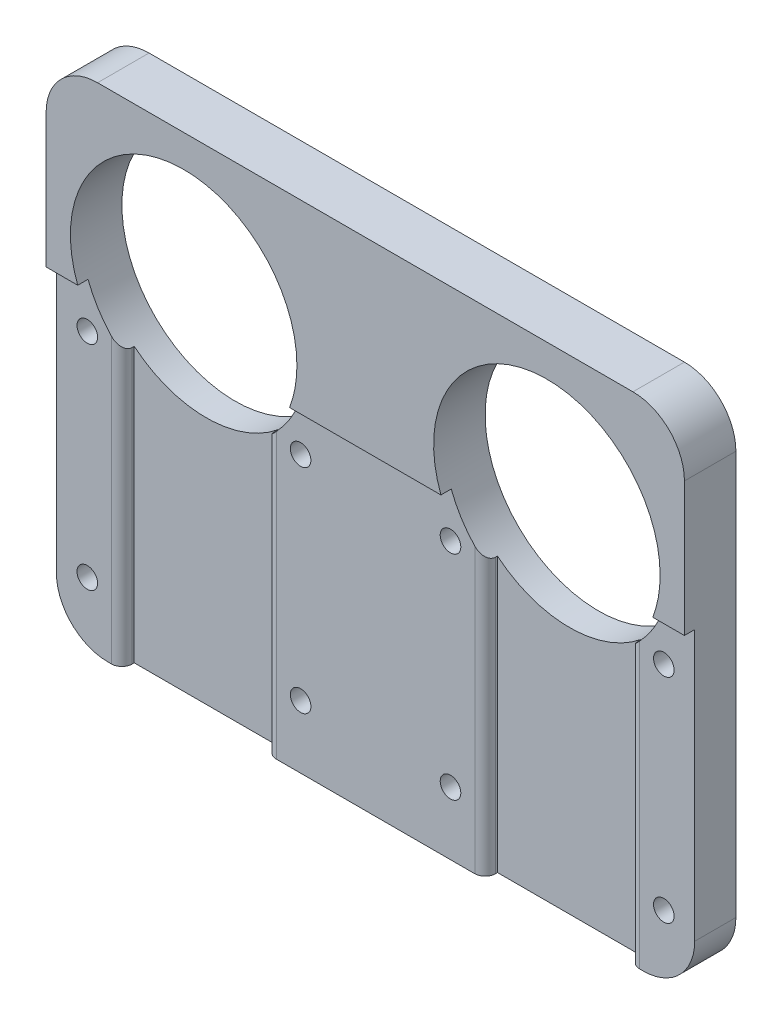
from build123d import *
from build123d.topology import SkipClean

# Parameters (mm, degrees)
SKETCH_1_W          = 62
SKETCH_1_H          = 45.22
EXTRUDE_1_DEPTH     = 4
SKETCH_7_W          = 62
SKETCH_7_H          = 4
EXTRUDE_4_DEPTH     = 4
SKETCH_2_R          = 11
SKETCH_2_R_2        = 1
CUT_EXTRUDE_1_DEPTH = 4
CUT_EXTRUDE_2_DEPTH = 1.2
FILLET_2_R          = 5
FILLET_4_R          = 5
FILLET_6_R          = 1
FILLET_7_R          = 1
FILLET_8_R          = 1
FILLET_9_R          = 1
SKETCH_3_R          = 2
CUT_EXTRUDE_6_DEPTH = 1.5
FILLET_10_R         = 5
FILLET_11_R         = 5
EXTRUDE_START       = 1
EXTRUDE_5_DEPTH     = 1


with BuildPart() as part:
    # 草图1 → 凸台-拉伸1 (new body)
    with BuildSketch(Plane.XY):
        with Locations((25.182910647, 19.462647059)):
            Rectangle(SKETCH_1_W, SKETCH_1_H)
    extrude(amount=EXTRUDE_1_DEPTH)

    # 草图7 → 凸台-拉伸4 (add)
    with BuildSketch(Plane(origin=(0, 42.072647059, 0), x_dir=(1, 0, 0), z_dir=(0, 1, 0))):
        with Locations((25.182910647, -2)):
            Rectangle(SKETCH_7_W, SKETCH_7_H)
    extrude(amount=EXTRUDE_4_DEPTH)

    # 草图2 → 切除-拉伸1 (cut)
    with BuildSketch(Plane.XY.offset(4)):
        with Locations((7.542910647, 31.962647059)):
            Circle(SKETCH_2_R)
        with Locations((42.822910647, 31.962647059)):
            Circle(SKETCH_2_R)
        with Locations((-2.817089353, 2.962647059)):
            Circle(SKETCH_2_R_2)
        with Locations((17.902910647, 2.962647059)):
            Circle(SKETCH_2_R_2)
        with Locations((-2.817089353, 23.662647059)):
            Circle(SKETCH_2_R_2)
        with Locations((17.902910647, 23.662647059)):
            Circle(SKETCH_2_R_2)
        with Locations((53.182910647, 2.962647059)):
            Circle(SKETCH_2_R_2)
        with Locations((32.462910647, 2.962647059)):
            Circle(SKETCH_2_R_2)
        with Locations((32.462910647, 23.662647059)):
            Circle(SKETCH_2_R_2)
        with Locations((53.182910647, 23.662647059)):
            Circle(SKETCH_2_R_2)
    extrude(amount=-CUT_EXTRUDE_1_DEPTH, mode=Mode.SUBTRACT)

    # 草图2<3> → 切除-拉伸2 (cut)
    with BuildSketch(Plane.XY.offset(4)):
        with BuildLine():
            Line((0.542910647, 23.477365685), (0.542910647, -3.147352941))
            Line((0.542910647, -3.147352941), (14.542910647, -3.147352941))
            Line((14.542910647, -3.147352941), (14.542910647, 23.477365685))
            ThreePointArc((14.542910647, 23.477365685), (7.542910647, 20.962647059), (0.542910647, 23.477365685))
        make_face()
        with BuildLine():
            Line((35.822910647, 23.477365685), (35.822910647, -3.147352941))
            Line((35.822910647, -3.147352941), (49.822910647, -3.147352941))
            Line((49.822910647, -3.147352941), (49.822910647, 23.477365685))
            ThreePointArc((49.822910647, 23.477365685), (42.822910647, 20.962647059), (35.822910647, 23.477365685))
        make_face()
    extrude(amount=-CUT_EXTRUDE_2_DEPTH, mode=Mode.SUBTRACT)

    # 圆角2
    fillet_2_edges = [part.edges().sort_by_distance(p)[0] for p in [
        (-5.817089353, -3.147352941, 2),
    ]]
    fillet(fillet_2_edges, radius=FILLET_2_R)

    # 圆角4
    fillet_4_edges = [part.edges().sort_by_distance(p)[0] for p in [
        (56.182910647, -3.147352941, 2),
    ]]
    fillet(fillet_4_edges, radius=FILLET_4_R)

    # 圆角6
    fillet_6_edges = [part.edges().sort_by_distance(p)[0] for p in [
        (14.542910647, 10.165006372, 4),
    ]]
    fillet(fillet_6_edges, radius=FILLET_6_R)

    # 圆角7
    fillet_7_edges = [part.edges().sort_by_distance(p)[0] for p in [
        (0.542910647, 10.165006372, 4),
    ]]
    fillet(fillet_7_edges, radius=FILLET_7_R)

    # 圆角8
    fillet_8_edges = [part.edges().sort_by_distance(p)[0] for p in [
        (35.822910647, 10.165006372, 4),
    ]]
    fillet(fillet_8_edges, radius=FILLET_8_R)

    # 圆角9
    fillet_9_edges = [part.edges().sort_by_distance(p)[0] for p in [
        (49.822910647, 10.165006372, 4),
    ]]
    fillet(fillet_9_edges, radius=FILLET_9_R)

    # 草图3 → 切除-拉伸6 (cut)
    with BuildSketch(Plane(origin=(0, 0, 0), x_dir=(-1, 0, 0), z_dir=(0, 0, -1))):
        with Locations((-53.182910647, 2.962647059)):
            Circle(SKETCH_3_R)
        with Locations((-32.462910647, 2.962647059)):
            Circle(SKETCH_3_R)
        with Locations((-17.902910647, 2.962647059)):
            Circle(SKETCH_3_R)
        with Locations((2.817089353, 2.962647059)):
            Circle(SKETCH_3_R)
        with Locations((-53.182910647, 23.662647059)):
            Circle(SKETCH_3_R)
        with Locations((-32.462910647, 23.662647059)):
            Circle(SKETCH_3_R)
        with Locations((-17.902910647, 23.662647059)):
            Circle(SKETCH_3_R)
        with Locations((2.817089353, 23.662647059)):
            Circle(SKETCH_3_R)
    extrude(amount=-CUT_EXTRUDE_6_DEPTH, mode=Mode.SUBTRACT)

    # 圆角10
    fillet_10_edges = [part.edges().sort_by_distance(p)[0] for p in [
        (56.182910647, 46.072647059, 2),
    ]]
    fillet(fillet_10_edges, radius=FILLET_10_R)

    # 圆角11
    fillet_11_edges = [part.edges().sort_by_distance(p)[0] for p in [
        (-5.817089353, 46.072647059, 2),
    ]]
    fillet(fillet_11_edges, radius=FILLET_11_R)

    # 草图8 → 凸台-拉伸5 (add)
    with SkipClean():  # the faces are left unmerged after this step: merging them gives an invalid solid
        with BuildSketch(Plane.XY.offset(4).offset(EXTRUDE_START)):
            with BuildLine():
                Line((53.112123445, 28.072647059), (56.182910647, 28.072647059))
                Line((56.182910647, 28.072647059), (56.182910647, 41.072647059))
                ThreePointArc((56.182910647, 41.072647059), (54.718444553, 44.608180965), (51.182910647, 46.072647059))
                Line((51.182910647, 46.072647059), (-0.817089353, 46.072647059))
                ThreePointArc((-0.817089353, 46.072647059), (-4.352623259, 44.608180965), (-5.817089353, 41.072647059))
                Line((-5.817089353, 41.072647059), (-5.817089353, 28.072647059))
                Line((-5.817089353, 28.072647059), (-2.746302151, 28.072647059))
                ThreePointArc((-2.746302151, 28.072647059), (7.542910647, 42.962647059), (17.832123445, 28.072647059))
                Line((17.832123445, 28.072647059), (32.533697849, 28.072647059))
                ThreePointArc((32.533697849, 28.072647059), (42.822910647, 42.962647059), (53.112123445, 28.072647059))
            make_face()
        extrude(amount=-EXTRUDE_5_DEPTH)


solid = part.part
